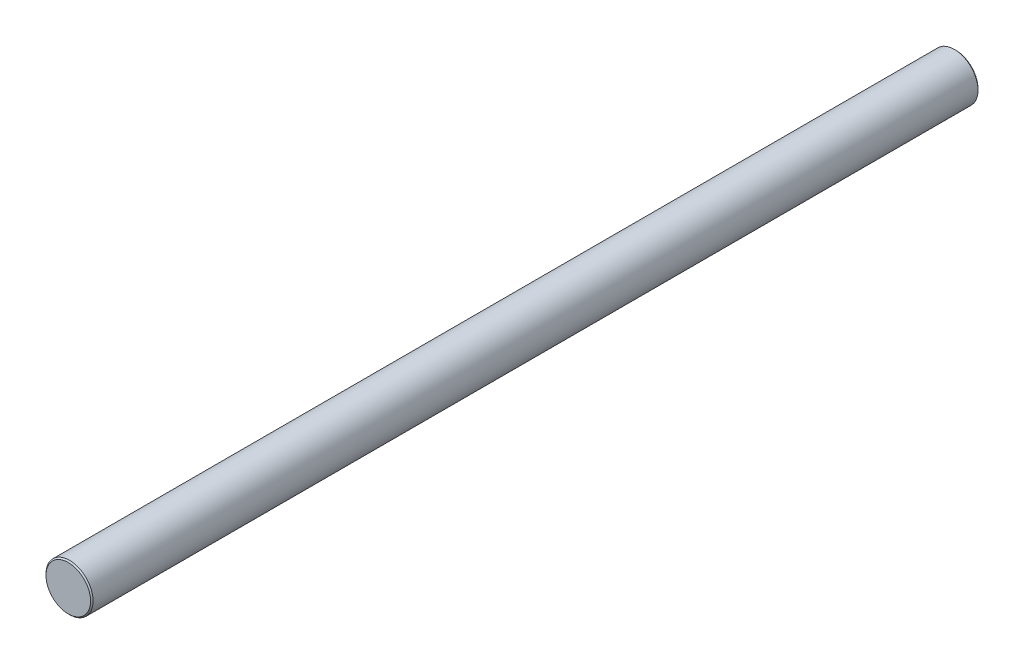
from build123d import *

# Parameters (mm, degrees)
SKETCH1_R           = 4.7625
BOSS_EXTRUDE1_DEPTH = 179.5526
CHAMFER1_SIZE       = 0.254


with BuildPart() as part:
    # Sketch1 → Boss-Extrude1 (new body)
    with BuildSketch(Plane.XY):
        Circle(SKETCH1_R)
    extrude(amount=BOSS_EXTRUDE1_DEPTH)

    # Chamfer1
    chamfer1_edges = [part.edges().sort_by_distance(p)[0] for p in [
        (-4.7625, 0, 0),
        (-4.7625, 0, 179.5526),
    ]]
    chamfer(chamfer1_edges, length=CHAMFER1_SIZE)


solid = part.part
